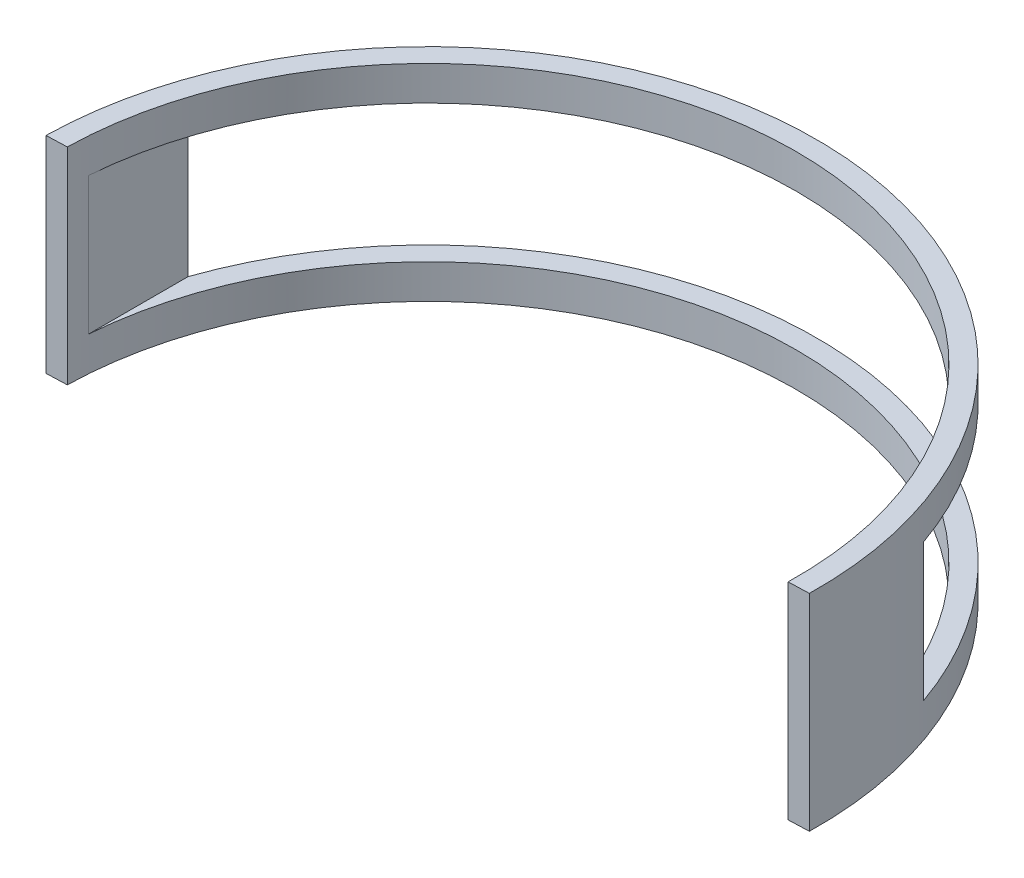
from build123d import *

# Parameters (mm, degrees)
BOSS_EXTRUDE1_DEPTH     = 15
CUT_EXTRUDE1_DEPTH      = 82.515026332
CUT_EXTRUDE1_DEPTH_BACK = 200
SKETCH3_W               = 107
SKETCH3_H               = 20


with BuildPart() as part:
    # Sketch1 → Boss-Extrude1 (new, symmetric)
    with BuildSketch(Plane(origin=(0, 0, 0), x_dir=(1, 0, 0), z_dir=(0, 1, 0))):
        with BuildLine():
            Line((-56.6451424, 1.085173475), (-53.646875163, 1.186754079))
            ThreePointArc((-53.646875163, 1.186754079), (1.186754079, 53.646875163), (53.646875163, -1.186754079))
            Line((53.646875163, -1.186754079), (56.645146911, -1.084937955))
            ThreePointArc((56.645146911, -1.084937955), (1.085055715, 56.645144656), (-56.6451424, 1.085173475))
        make_face()
    extrude(amount=BOSS_EXTRUDE1_DEPTH, both=True)

    # Sketch3 → Cut-Extrude1 (cut, two sides: drawn at the far end of the back side and taken through both)
    with BuildSketch(Plane.XY.offset(-CUT_EXTRUDE1_DEPTH_BACK)):
        Rectangle(SKETCH3_W, SKETCH3_H)
    extrude(amount=CUT_EXTRUDE1_DEPTH + CUT_EXTRUDE1_DEPTH_BACK, mode=Mode.SUBTRACT)


solid = part.part
